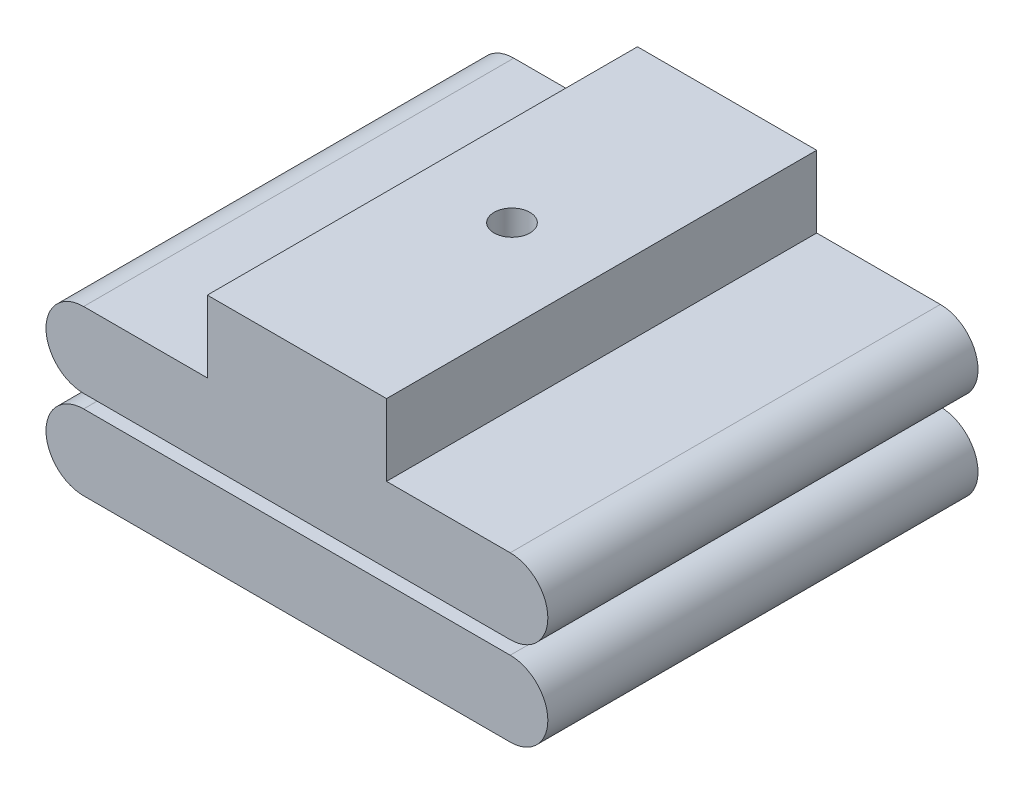
from build123d import *
from build123d.topology import SkipClean

# Parameters (mm, degrees)
BOSS_EXTRUDE1_DEPTH = 10
BOSS_EXTRUDE2_DEPTH = 2
CUT_REVOLVE1_ANGLE  = 180
LPATTERN1_COUNT     = 2
LPATTERN1_PITCH     = 4.95
CUT_EXTRUDE1_START  = -7.55
SKETCH7_R           = 1
CUT_EXTRUDE1_DEPTH  = 7.55
SKETCH8_W           = 10
SKETCH8_H           = 24
SKETCH8_R           = 1
BOSS_EXTRUDE3_DEPTH = 4
FILLET1_R           = 1


with BuildPart() as part:
    # Sketch1 → Boss-Extrude1 (new body)
    with BuildSketch(Plane.XY):
        with BuildLine():
            Line((-11.9, 0), (11.9, 0))
            ThreePointArc((11.9, 0), (14, -2.1), (11.9, -4.2))
            Line((11.9, -4.2), (-11.9, -4.2))
            ThreePointArc((-11.9, -4.2), (-14, -2.1), (-11.9, 0))
        make_face()
        with BuildLine():
            Line((-11.9, -1.6), (11.9, -1.6))
            ThreePointArc((11.9, -1.6), (12.4, -2.1), (11.9, -2.6))
            Line((11.9, -2.6), (-11.9, -2.6))
            ThreePointArc((-11.9, -2.6), (-12.4, -2.1), (-11.9, -1.6))
        make_face(mode=Mode.SUBTRACT)
    boss_extrude1 = extrude(amount=BOSS_EXTRUDE1_DEPTH)

    # Sketch4 → Boss-Extrude2 (add)
    with BuildSketch(Plane.XY.offset(10)):
        with BuildLine():
            Line((11.9, 0), (-11.9, 0))
            ThreePointArc((-11.9, 0), (-14, -2.1), (-11.9, -4.2))
            Line((-11.9, -4.2), (11.9, -4.2))
            ThreePointArc((11.9, -4.2), (14, -2.1), (11.9, 0))
        make_face()
    boss_extrude2 = extrude(amount=BOSS_EXTRUDE2_DEPTH)

    # Sketch3 → Cut-Revolve1 (revolve, cut)
    with BuildSketch(Plane.XY.offset(10)):
        with BuildLine():
            Line((0, -2.1), (0, -1.6))
            Line((0, -1.6), (-11.9, -1.6))
            ThreePointArc((-11.9, -1.6), (-12.253553391, -1.746446609), (-12.4, -2.1))
            Line((-12.4, -2.1), (0, -2.1))
        make_face()
        with BuildLine():
            Line((11.9, -1.6), (0, -1.6))
            Line((0, -1.6), (0, -2.1))
            Line((0, -2.1), (12.4, -2.1))
            ThreePointArc((12.4, -2.1), (12.253553391, -1.746446609), (11.9, -1.6))
        make_face()
    cut_revolve1 = revolve(axis=Axis((-12.4, -2.1, 10), (1, 0, 0)), revolution_arc=CUT_REVOLVE1_ANGLE, mode=Mode.SUBTRACT)

    # Mirror1: Boss-Extrude1, Boss-Extrude2, Cut-Revolve1 across plane
    add(boss_extrude1.mirror(Plane.XY))
    add(boss_extrude2.mirror(Plane.XY))
    add(cut_revolve1.mirror(Plane.XY), mode=Mode.SUBTRACT)


with BuildPart() as lpattern1_1:
    # LPattern1: pattern copy
    add(part.part.moved(Location(Vector(0, -1, 0) * (1 * LPATTERN1_PITCH))))


with BuildPart() as part_1:
    add(part.part)

    add(lpattern1_1.part)  # Revolve1 merges LPattern1_1
    # Sketch6 → Revolve1 (revolve)
    with BuildSketch(Plane.XY, mode=Mode.PRIVATE) as revolve1_sk:
        with BuildLine():
            Line((-3.775, -4.2), (-1, -4.2))
            Line((-1, -4.2), (-1, -4.95))
            Line((-1, -4.95), (-3.775, -4.95))
            ThreePointArc((-3.775, -4.95), (-3.4, -4.575), (-3.775, -4.2))
        make_face()
    revolve(revolve1_sk.sketch.rotate(Axis((0, 0, 0), (0, -1, 0)), 270), axis=Axis((0, 0, 0), (0, -1, 0)))

    # Sketch7 → Cut-Extrude1 (cut)
    with SkipClean():  # the faces are left unmerged after this step: merging them gives an invalid solid
        with BuildSketch(Plane(origin=(0, 0, 0), x_dir=(1, 0, 0), z_dir=(0, 1, 0)).offset(CUT_EXTRUDE1_START)):
            with Locations(Location((0, 0, 0), (0, 0, 180))):
                Circle(SKETCH7_R)
        extrude(amount=CUT_EXTRUDE1_DEPTH, mode=Mode.SUBTRACT)

    # Sketch8 → Boss-Extrude3 (add)
    with SkipClean():  # the faces are left unmerged after this step: merging them gives an invalid solid
        with BuildSketch(Plane(origin=(0, 0, 0), x_dir=(1, 0, 0), z_dir=(0, 1, 0))):
            Rectangle(SKETCH8_W, SKETCH8_H)
            with Locations(Location((0, 0, 0), (0, 0, 180))):
                Circle(SKETCH8_R, mode=Mode.SUBTRACT)
        extrude(amount=BOSS_EXTRUDE3_DEPTH)

    # Fillet1
    fillet1_edges = [part_1.edges().sort_by_distance(p)[0] for p in [
        (1, -2.6, 0),
        (1, -1.6, 0),
        (1, -6.55, 0),
    ]]
    fillet(fillet1_edges, radius=FILLET1_R)


solid = part_1.part
